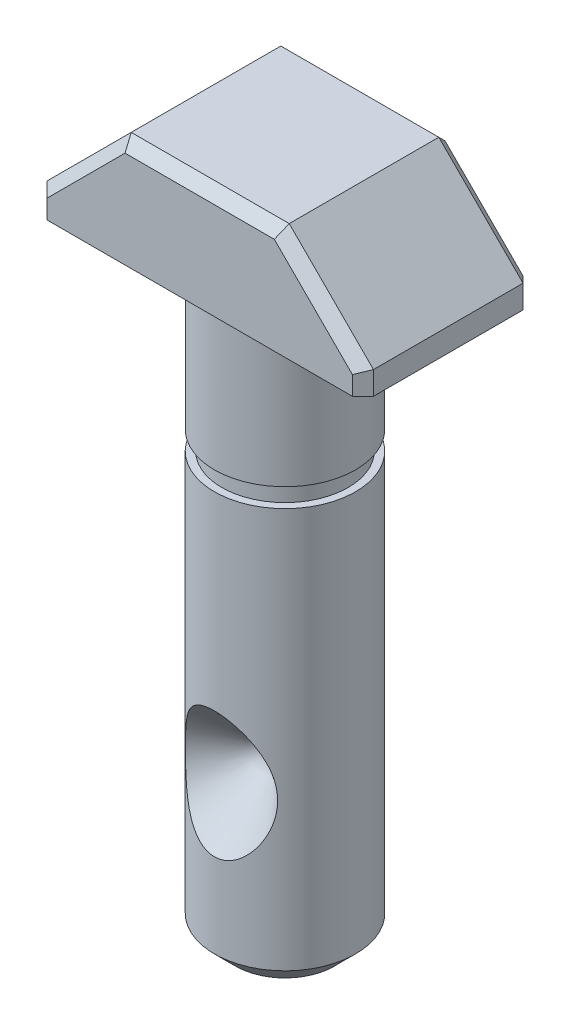
from build123d import *

# Parameters (mm, degrees)
SKETCH_1_W      = 15.5
SKETCH_1_H      = 5.1
EXTRUDE_1_DEPTH = 8.1
CHAMFER_1_SIZE  = 4
CHAMFER_2_SIZE  = 0.5
SKETCH_2_R      = 3.35
EXTRUDE_2_DEPTH = 7
SKETCH_3_R      = 3
EXTRUDE_3_DEPTH = 0.9
SKETCH_5_R      = 3.35
EXTRUDE_4_DEPTH = 20
CHAMFER_3_SIZE  = 1


with BuildPart() as part:
    # 草图1 → 凸台-拉伸1 (new body)
    with BuildSketch(Plane.XY):
        Rectangle(SKETCH_1_W, SKETCH_1_H)
    extrude(amount=EXTRUDE_1_DEPTH)

    # 倒角1
    chamfer_1_edges = [part.edges().sort_by_distance(p)[0] for p in [
        (-7.75, 2.55, 4.05),
        (7.75, 2.55, 4.05),
    ]]
    chamfer(chamfer_1_edges, length=CHAMFER_1_SIZE)

    # 倒角2
    chamfer_2_edges = [part.edges().sort_by_distance(p)[0] for p in [
        (0, 2.55, 0),
        (0, 2.55, 8.1),
        (-7.75, -2, 0),
        (-5.75, 0.55, 0),
        (5.75, 0.55, 0),
        (-7.75, -2, 8.1),
        (-5.75, 0.55, 8.1),
        (5.75, 0.55, 8.1),
        (7.75, -2, 8.1),
        (7.75, -2, 0),
    ]]
    chamfer(chamfer_2_edges, length=CHAMFER_2_SIZE)

    # 草图2 → 凸台-拉伸2 (add)
    with BuildSketch(Plane.XZ.offset(2.55)):
        with Locations(Location((0, 4.05, 0), (0, 0, 90))):
            Circle(SKETCH_2_R)
    extrude(amount=EXTRUDE_2_DEPTH)

    # 草图3 → 凸台-拉伸3 (add)
    with BuildSketch(Plane.XZ.offset(9.55)):
        with Locations(Location((0, 4.05, 0), (0, 0, 270))):
            Circle(SKETCH_3_R)
    extrude(amount=EXTRUDE_3_DEPTH)

    # 草图5 → 凸台-拉伸4 (add)
    with BuildSketch(Plane.XZ.offset(10.45)):
        with Locations(Location((0, 4.05, 0), (0, 0, 90))):
            Circle(SKETCH_5_R)
    extrude(amount=EXTRUDE_4_DEPTH)

    # 倒角3
    chamfer_3_edges = [part.edges().sort_by_distance(p)[0] for p in [
        (0, -30.45, 0.7),
    ]]
    chamfer(chamfer_3_edges, length=CHAMFER_3_SIZE)

    # 草图6 → 切除-旋转1 (revolve, cut)
    with BuildSketch(Plane(origin=(0, 0, 0), x_dir=(0, 0, -1), z_dir=(1, 0, 0)), mode=Mode.PRIVATE) as cut_revolve_1_sk:
        Polygon((-7.4, -22.455131571), (-7.4, -19.455131571), (-4.4, -22.455131571), align=None)
    revolve(cut_revolve_1_sk.sketch.rotate(Axis((0, -22.455131571, 7.4), (0, 0, -1)), 90), axis=Axis((0, -22.455131571, 7.4), (0, 0, -1)), mode=Mode.SUBTRACT)


solid = part.part
